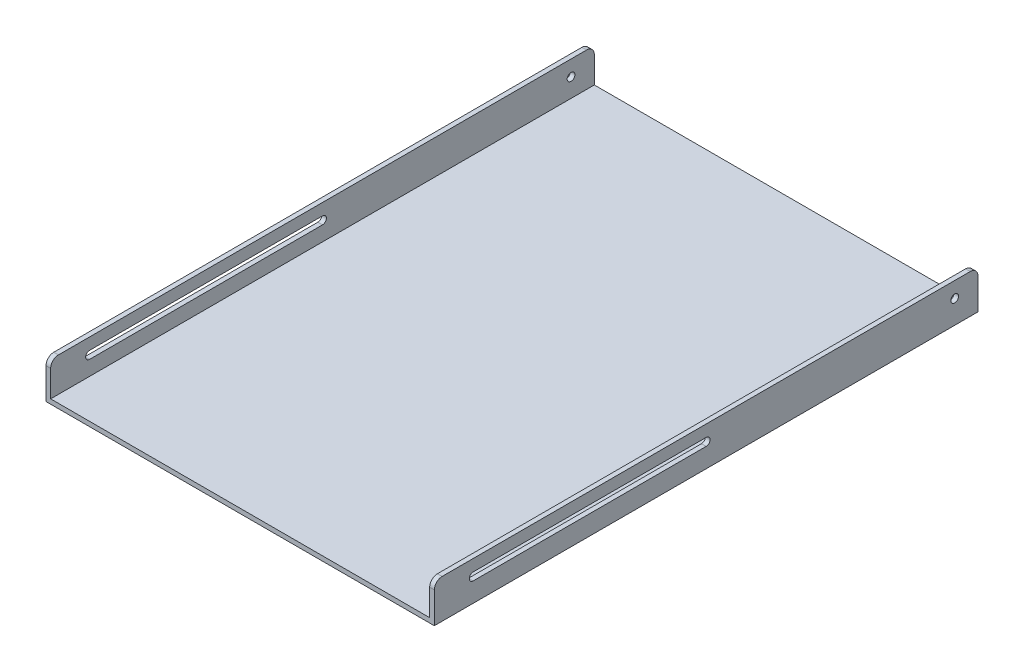
from build123d import *

# Parameters (mm, degrees)
EXTRUDE_THIN1_DEPTH     = 350
CUT_EXTRUDE1_DEPTH      = 613.372435696
CUT_EXTRUDE1_DEPTH_BACK = 613.372435696
SKETCH2_R               = 5
FILLET1_R               = 10


with BuildPart() as part:
    # Sketch1 → Extrude-Thin1 (new, symmetric)
    with BuildSketch(Plane.XY):
        Polygon((-250, 50), (-250, 0), (250, 0), (250, 50), (244, 50), (244, 6), (-244, 6), (-244, 50), align=None)
    extrude(amount=EXTRUDE_THIN1_DEPTH, both=True)

    # Sketch2 → Cut-Extrude1 (cut, two sides: drawn at the far end of the back side and taken through both)
    with BuildSketch(Plane(origin=(250, 0, 0), x_dir=(0, 0, -1), z_dir=(1, 0, 0)).offset(-CUT_EXTRUDE1_DEPTH_BACK)):
        with Locations((320, 30)):
            Circle(SKETCH2_R)
        with BuildLine():
            Line((-300, 35), (0, 35))
            ThreePointArc((0, 35), (5, 30), (0, 25))
            Line((0, 25), (-300, 25))
            ThreePointArc((-300, 25), (-305, 30), (-300, 35))
        make_face()
    extrude(amount=CUT_EXTRUDE1_DEPTH + CUT_EXTRUDE1_DEPTH_BACK, mode=Mode.SUBTRACT)

    # Fillet1
    fillet1_edges = [part.edges().sort_by_distance(p)[0] for p in [
        (247, 50, 350),
        (247, 50, -350),
        (-247, 50, 350),
        (-247, 50, -350),
    ]]
    fillet(fillet1_edges, radius=FILLET1_R)


solid = part.part
